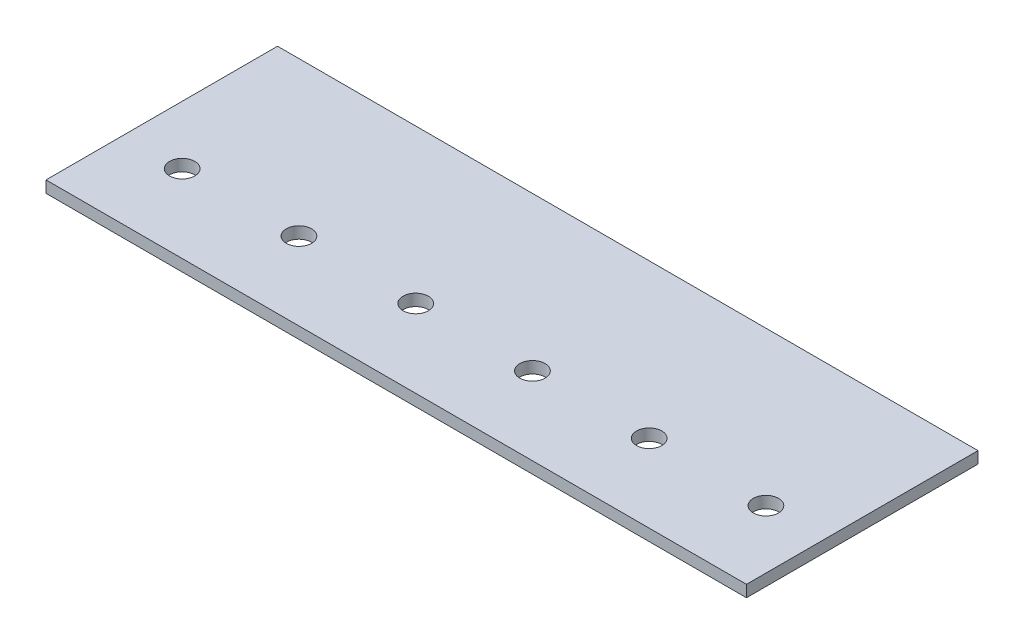
from build123d import *

# Parameters (mm, degrees)
SKIZZE1_W                       = 180
SKIZZE1_H                       = 59.5
AUFSATZ_LINEAR_AUSTRAGEN1_DEPTH = 3
SKIZZE2_R                       = 3.25
SCHNITT_LINEAR_AUSTRAGEN1_DEPTH = 3


with BuildPart() as part:
    # Skizze1 → Aufsatz-Linear austragen1 (new body)
    with BuildSketch(Plane(origin=(0, 0, 0), x_dir=(1, 0, 0), z_dir=(0, 1, 0))):
        Rectangle(SKIZZE1_W, SKIZZE1_H)
    extrude(amount=AUFSATZ_LINEAR_AUSTRAGEN1_DEPTH)

    # Skizze2 → Schnitt-Linear austragen1 (cut)
    with BuildSketch(Plane(origin=(0, 3, 0), x_dir=(1, 0, 0), z_dir=(0, 1, 0))):
        with Locations(Location((-75, -9.75, 0), (0, 0, 270))):
            Circle(SKIZZE2_R)
        with Locations(Location((-45, -9.75, 0), (0, 0, 270))):
            Circle(SKIZZE2_R)
        with Locations(Location((-15, -9.75, 0), (0, 0, 270))):
            Circle(SKIZZE2_R)
        with Locations(Location((15, -9.75, 0), (0, 0, 270))):
            Circle(SKIZZE2_R)
        with Locations(Location((45, -9.75, 0), (0, 0, 270))):
            Circle(SKIZZE2_R)
        with Locations(Location((75, -9.75, 0), (0, 0, 270))):
            Circle(SKIZZE2_R)
    extrude(amount=-SCHNITT_LINEAR_AUSTRAGEN1_DEPTH, mode=Mode.SUBTRACT)


solid = part.part
